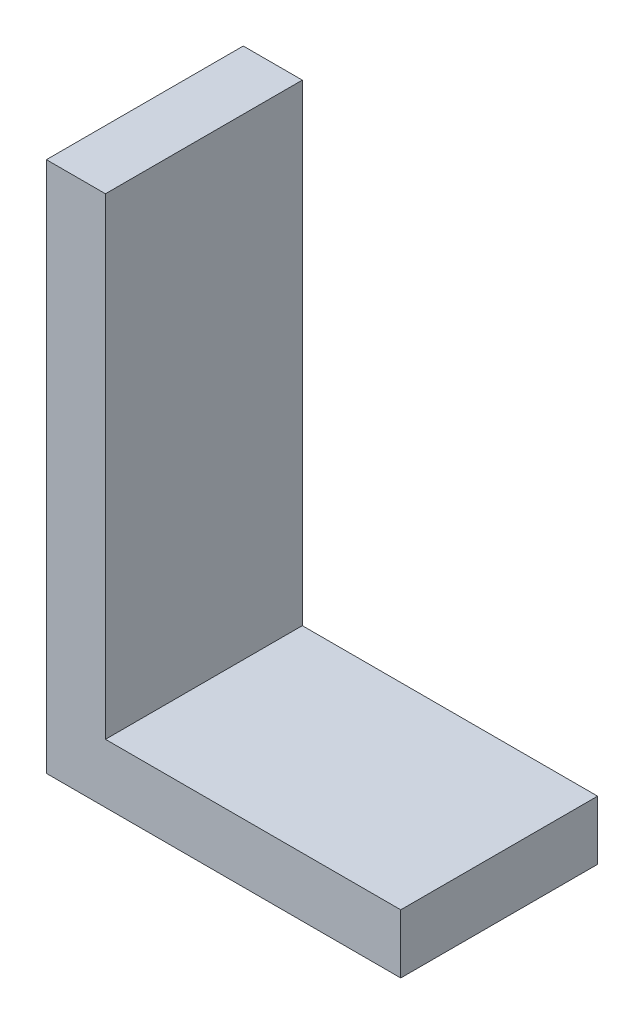
from build123d import *

# Parameters (mm, degrees)
BOSS_EXTRUDE1_DEPTH = 10


with BuildPart() as part:
    # Sketch1 → Boss-Extrude1 (new body)
    with BuildSketch(Plane.XY):
        Polygon((0, 0), (0, -27), (18, -27), (18, -24), (3, -24), (3, 0), align=None)
    extrude(amount=BOSS_EXTRUDE1_DEPTH)


solid = part.part
